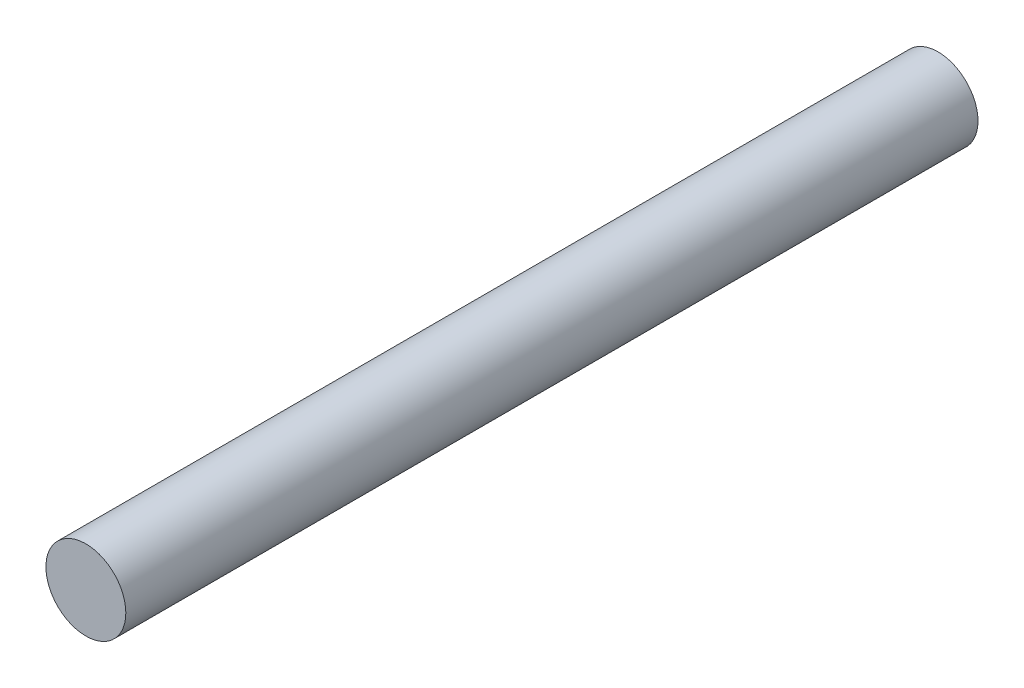
from build123d import *

# Parameters (mm, degrees)
ESQUISSE1_R      = 1.5
EXTRUSION1_DEPTH = 32


with BuildPart() as part:
    # Esquisse1 → Extrusion1 (new body)
    with BuildSketch(Plane.XY):
        Circle(ESQUISSE1_R)
    extrude(amount=EXTRUSION1_DEPTH)


solid = part.part
